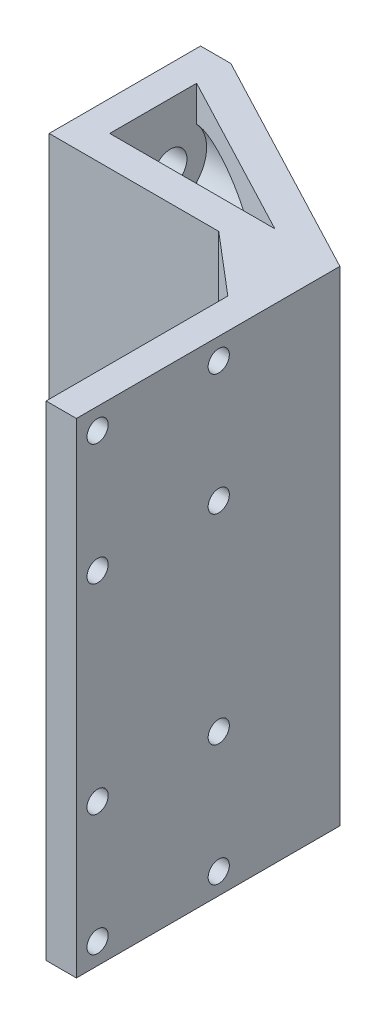
from build123d import *

# Parameters (mm, degrees)
ESQUISSE1_W             = 43
ESQUISSE1_H             = 80
BOSS_EXTRU_1_DEPTH      = 5
ESQUISSE2_W             = 5
ESQUISSE2_H             = 80
BOSS_EXTRU_2_DEPTH      = 38.5
ENL_V_MAT_EXTRU_1_REACH = 84.692
ESQUISSE3_R             = 1.75
ESQUISSE4_W             = 5
ESQUISSE4_H             = 80
BOSS_EXTRU_3_DEPTH      = 20
ENL_V_MAT_EXTRU_2_REACH = 82.206
ESQUISSE5_R             = 2.75
ENL_V_MAT_EXTRU_3_REACH = 80.13
ESQUISSE6_R             = 1.5
BOSS_EXTRU_4_DEPTH      = 80
ENL_V_MAT_EXTRU_4_REACH = 82.206
ESQUISSE8_R             = 6
CHANFREIN2_SIZE         = 8.5
CHANFREIN2_SIZE2        = 10


with BuildPart() as part:
    # Esquisse1 → Boss.-Extru.1 (new body)
    with BuildSketch(Plane.XY):
        with Locations((-11.896872358, -15.648351648)):
            Rectangle(ESQUISSE1_W, ESQUISSE1_H)
    extrude(amount=BOSS_EXTRU_1_DEPTH)

    # Esquisse2 → Boss.-Extru.2 (add)
    with BuildSketch(Plane(origin=(0, 0, 5), x_dir=(-1, 0, 0), z_dir=(0, 0, -1))):
        with Locations((-7.103127642, -15.648351648)):
            Rectangle(ESQUISSE2_W, ESQUISSE2_H)
    extrude(amount=-BOSS_EXTRU_2_DEPTH)

    # Esquisse3 → Enlèv. mat.-Extru.1 (cut, up to next)
    with BuildSketch(Plane(origin=(9.603127642, 0, 0), x_dir=(0, 0, -1), z_dir=(1, 0, 0)), mode=Mode.PRIVATE) as enl_v_mat_extru_1_sk1:
        with Locations(Location((-40, -52.148351648, 0), (0, 0, 90))):
            Circle(ESQUISSE3_R)
    enl_v_mat_extru_1_tool1 = extrude(enl_v_mat_extru_1_sk1.sketch, amount=-ENL_V_MAT_EXTRU_1_REACH, mode=Mode.PRIVATE) & part.part
    # Esquisse3 → Enlèv. mat.-Extru.1 (cut, up to next)
    with BuildSketch(Plane(origin=(9.603127642, 0, 0), x_dir=(0, 0, -1), z_dir=(1, 0, 0)), mode=Mode.PRIVATE) as enl_v_mat_extru_1_sk2:
        with Locations(Location((-40, -32.148351648, 0), (0, 0, 90))):
            Circle(ESQUISSE3_R)
    enl_v_mat_extru_1_tool2 = extrude(enl_v_mat_extru_1_sk2.sketch, amount=-ENL_V_MAT_EXTRU_1_REACH, mode=Mode.PRIVATE) & part.part
    # Esquisse3 → Enlèv. mat.-Extru.1 (cut, up to next)
    with BuildSketch(Plane(origin=(9.603127642, 0, 0), x_dir=(0, 0, -1), z_dir=(1, 0, 0)), mode=Mode.PRIVATE) as enl_v_mat_extru_1_sk3:
        with Locations(Location((-20, -32.148351648, 0), (0, 0, 90))):
            Circle(ESQUISSE3_R)
    enl_v_mat_extru_1_tool3 = extrude(enl_v_mat_extru_1_sk3.sketch, amount=-ENL_V_MAT_EXTRU_1_REACH, mode=Mode.PRIVATE) & part.part
    # Esquisse3 → Enlèv. mat.-Extru.1 (cut, up to next)
    with BuildSketch(Plane(origin=(9.603127642, 0, 0), x_dir=(0, 0, -1), z_dir=(1, 0, 0)), mode=Mode.PRIVATE) as enl_v_mat_extru_1_sk4:
        with Locations(Location((-20, -52.148351648, 0), (0, 0, 90))):
            Circle(ESQUISSE3_R)
    enl_v_mat_extru_1_tool4 = extrude(enl_v_mat_extru_1_sk4.sketch, amount=-ENL_V_MAT_EXTRU_1_REACH, mode=Mode.PRIVATE) & part.part
    # Esquisse3 → Enlèv. mat.-Extru.1 (cut, up to next)
    with BuildSketch(Plane(origin=(9.603127642, 0, 0), x_dir=(0, 0, -1), z_dir=(1, 0, 0)), mode=Mode.PRIVATE) as enl_v_mat_extru_1_sk5:
        with Locations(Location((-40, 0.851648352, 0), (0, 0, 90))):
            Circle(ESQUISSE3_R)
    enl_v_mat_extru_1_tool5 = extrude(enl_v_mat_extru_1_sk5.sketch, amount=-ENL_V_MAT_EXTRU_1_REACH, mode=Mode.PRIVATE) & part.part
    # Esquisse3 → Enlèv. mat.-Extru.1 (cut, up to next)
    with BuildSketch(Plane(origin=(9.603127642, 0, 0), x_dir=(0, 0, -1), z_dir=(1, 0, 0)), mode=Mode.PRIVATE) as enl_v_mat_extru_1_sk6:
        with Locations(Location((-40, 20.851648352, 0), (0, 0, 90))):
            Circle(ESQUISSE3_R)
    enl_v_mat_extru_1_tool6 = extrude(enl_v_mat_extru_1_sk6.sketch, amount=-ENL_V_MAT_EXTRU_1_REACH, mode=Mode.PRIVATE) & part.part
    # Esquisse3 → Enlèv. mat.-Extru.1 (cut, up to next)
    with BuildSketch(Plane(origin=(9.603127642, 0, 0), x_dir=(0, 0, -1), z_dir=(1, 0, 0)), mode=Mode.PRIVATE) as enl_v_mat_extru_1_sk7:
        with Locations(Location((-20, 20.851648352, 0), (0, 0, 90))):
            Circle(ESQUISSE3_R)
    enl_v_mat_extru_1_tool7 = extrude(enl_v_mat_extru_1_sk7.sketch, amount=-ENL_V_MAT_EXTRU_1_REACH, mode=Mode.PRIVATE) & part.part
    # Esquisse3 → Enlèv. mat.-Extru.1 (cut, up to next)
    with BuildSketch(Plane(origin=(9.603127642, 0, 0), x_dir=(0, 0, -1), z_dir=(1, 0, 0)), mode=Mode.PRIVATE) as enl_v_mat_extru_1_sk8:
        with Locations(Location((-20, 0.851648352, 0), (0, 0, 90))):
            Circle(ESQUISSE3_R)
    enl_v_mat_extru_1_tool8 = extrude(enl_v_mat_extru_1_sk8.sketch, amount=-ENL_V_MAT_EXTRU_1_REACH, mode=Mode.PRIVATE) & part.part
    add(enl_v_mat_extru_1_tool1.solids().sort_by_distance((9.603128, -52.148352, 40))[0], mode=Mode.SUBTRACT)
    add(enl_v_mat_extru_1_tool2.solids().sort_by_distance((9.603128, -32.148352, 40))[0], mode=Mode.SUBTRACT)
    add(enl_v_mat_extru_1_tool3.solids().sort_by_distance((9.603128, -32.148352, 20))[0], mode=Mode.SUBTRACT)
    add(enl_v_mat_extru_1_tool4.solids().sort_by_distance((9.603128, -52.148352, 20))[0], mode=Mode.SUBTRACT)
    add(enl_v_mat_extru_1_tool5.solids().sort_by_distance((9.603128, 0.851648, 40))[0], mode=Mode.SUBTRACT)
    add(enl_v_mat_extru_1_tool6.solids().sort_by_distance((9.603128, 20.851648, 40))[0], mode=Mode.SUBTRACT)
    add(enl_v_mat_extru_1_tool7.solids().sort_by_distance((9.603128, 20.851648, 20))[0], mode=Mode.SUBTRACT)
    add(enl_v_mat_extru_1_tool8.solids().sort_by_distance((9.603128, 0.851648, 20))[0], mode=Mode.SUBTRACT)

    # Esquisse4 → Boss.-Extru.3 (add)
    with BuildSketch(Plane(origin=(0, 0, 0), x_dir=(-1, 0, 0), z_dir=(0, 0, -1))):
        with Locations((30.896872358, -15.648351648)):
            Rectangle(ESQUISSE4_W, ESQUISSE4_H)
    extrude(amount=BOSS_EXTRU_3_DEPTH)

    # Esquisse5 → Enlèv. mat.-Extru.2 (cut, up to next)
    with BuildSketch(Plane(origin=(-28.396872358, 0, 0), x_dir=(0, 0, -1), z_dir=(1, 0, 0)), mode=Mode.PRIVATE) as enl_v_mat_extru_2_sk1:
        with Locations(Location((10, 14.351648352, 0), (0, 0, 90))):
            Circle(ESQUISSE5_R)
    enl_v_mat_extru_2_tool1 = extrude(enl_v_mat_extru_2_sk1.sketch, amount=-ENL_V_MAT_EXTRU_2_REACH, mode=Mode.PRIVATE) & part.part
    # Esquisse5 → Enlèv. mat.-Extru.2 (cut, up to next)
    with BuildSketch(Plane(origin=(-28.396872358, 0, 0), x_dir=(0, 0, -1), z_dir=(1, 0, 0)), mode=Mode.PRIVATE) as enl_v_mat_extru_2_sk2:
        with Locations(Location((10, -5.648351648, 0), (0, 0, 90))):
            Circle(ESQUISSE5_R)
    enl_v_mat_extru_2_tool2 = extrude(enl_v_mat_extru_2_sk2.sketch, amount=-ENL_V_MAT_EXTRU_2_REACH, mode=Mode.PRIVATE) & part.part
    # Esquisse5 → Enlèv. mat.-Extru.2 (cut, up to next)
    with BuildSketch(Plane(origin=(-28.396872358, 0, 0), x_dir=(0, 0, -1), z_dir=(1, 0, 0)), mode=Mode.PRIVATE) as enl_v_mat_extru_2_sk3:
        with Locations(Location((10, -25.648351648, 0), (0, 0, 90))):
            Circle(ESQUISSE5_R)
    enl_v_mat_extru_2_tool3 = extrude(enl_v_mat_extru_2_sk3.sketch, amount=-ENL_V_MAT_EXTRU_2_REACH, mode=Mode.PRIVATE) & part.part
    # Esquisse5 → Enlèv. mat.-Extru.2 (cut, up to next)
    with BuildSketch(Plane(origin=(-28.396872358, 0, 0), x_dir=(0, 0, -1), z_dir=(1, 0, 0)), mode=Mode.PRIVATE) as enl_v_mat_extru_2_sk4:
        with Locations(Location((10, -45.648351648, 0), (0, 0, 90))):
            Circle(ESQUISSE5_R)
    enl_v_mat_extru_2_tool4 = extrude(enl_v_mat_extru_2_sk4.sketch, amount=-ENL_V_MAT_EXTRU_2_REACH, mode=Mode.PRIVATE) & part.part
    add(enl_v_mat_extru_2_tool1.solids().sort_by_distance((-28.396872, 14.351648, -10))[0], mode=Mode.SUBTRACT)
    add(enl_v_mat_extru_2_tool2.solids().sort_by_distance((-28.396872, -5.648352, -10))[0], mode=Mode.SUBTRACT)
    add(enl_v_mat_extru_2_tool3.solids().sort_by_distance((-28.396872, -25.648352, -10))[0], mode=Mode.SUBTRACT)
    add(enl_v_mat_extru_2_tool4.solids().sort_by_distance((-28.396872, -45.648352, -10))[0], mode=Mode.SUBTRACT)

    # Esquisse6 → Enlèv. mat.-Extru.3 (cut, up to next)
    with BuildSketch(Plane(origin=(0, 0, 0), x_dir=(-1, 0, 0), z_dir=(0, 0, -1)), mode=Mode.PRIVATE) as enl_v_mat_extru_3_sk1:
        with Locations((18.396872358, -45.648351648)):
            Circle(ESQUISSE6_R)
    enl_v_mat_extru_3_tool1 = extrude(enl_v_mat_extru_3_sk1.sketch, amount=-ENL_V_MAT_EXTRU_3_REACH, mode=Mode.PRIVATE) & part.part
    add(enl_v_mat_extru_3_tool1.solids().sort_by_distance((-18.396872, -45.648352, 0))[0], mode=Mode.SUBTRACT)

    # Esquisse7 → Boss.-Extru.4 (add)
    with BuildSketch(Plane(origin=(0, 24.351648352, 0), x_dir=(1, 0, 0), z_dir=(0, 1, 0))):
        Polygon((9.603127642, 0), (-28.396872358, 20), (-28.396872358, 14.349760381), (-1.132327635, 0), align=None)
    extrude(amount=-BOSS_EXTRU_4_DEPTH)

    # Enlèv. mat.-Extru.4: up to this plane
    enl_v_mat_extru_4_end = Plane(origin=(9.603127642, -98.590172756, 0), z_dir=(0.46574643283262246, 0, -0.8849182223819824))
    # Esquisse8 → Enlèv. mat.-Extru.4 (cut, up to the surface)
    with BuildSketch(Plane(origin=(-28.396872358, 0, 0), x_dir=(0, 0, -1), z_dir=(1, 0, 0)), mode=Mode.PRIVATE) as enl_v_mat_extru_4_sk1:
        with Locations(Location((10, -45.648351648, 0), (0, 0, 316.465525683))):
            Circle(ESQUISSE8_R)
    enl_v_mat_extru_4_tool1 = split(extrude(enl_v_mat_extru_4_sk1.sketch, amount=ENL_V_MAT_EXTRU_4_REACH, mode=Mode.PRIVATE), bisect_by=enl_v_mat_extru_4_end, keep=Keep.BOTH, mode=Mode.PRIVATE)
    add(enl_v_mat_extru_4_tool1.solids().sort_by_distance((-28.396872, -45.648352, -10))[0], mode=Mode.SUBTRACT)
    # Esquisse8 → Enlèv. mat.-Extru.4 (cut, up to the surface)
    with BuildSketch(Plane(origin=(-28.396872358, 0, 0), x_dir=(0, 0, -1), z_dir=(1, 0, 0)), mode=Mode.PRIVATE) as enl_v_mat_extru_4_sk2:
        with Locations(Location((10, -25.648351648, 0), (0, 0, 316.465525683))):
            Circle(ESQUISSE8_R)
    enl_v_mat_extru_4_tool2 = split(extrude(enl_v_mat_extru_4_sk2.sketch, amount=ENL_V_MAT_EXTRU_4_REACH, mode=Mode.PRIVATE), bisect_by=enl_v_mat_extru_4_end, keep=Keep.BOTH, mode=Mode.PRIVATE)
    add(enl_v_mat_extru_4_tool2.solids().sort_by_distance((-28.396872, -25.648352, -10))[0], mode=Mode.SUBTRACT)
    # Esquisse8 → Enlèv. mat.-Extru.4 (cut, up to the surface)
    with BuildSketch(Plane(origin=(-28.396872358, 0, 0), x_dir=(0, 0, -1), z_dir=(1, 0, 0)), mode=Mode.PRIVATE) as enl_v_mat_extru_4_sk3:
        with Locations(Location((10, -5.648351648, 0), (0, 0, 316.465525683))):
            Circle(ESQUISSE8_R)
    enl_v_mat_extru_4_tool3 = split(extrude(enl_v_mat_extru_4_sk3.sketch, amount=ENL_V_MAT_EXTRU_4_REACH, mode=Mode.PRIVATE), bisect_by=enl_v_mat_extru_4_end, keep=Keep.BOTH, mode=Mode.PRIVATE)
    add(enl_v_mat_extru_4_tool3.solids().sort_by_distance((-28.396872, -5.648352, -10))[0], mode=Mode.SUBTRACT)
    # Esquisse8 → Enlèv. mat.-Extru.4 (cut, up to the surface)
    with BuildSketch(Plane(origin=(-28.396872358, 0, 0), x_dir=(0, 0, -1), z_dir=(1, 0, 0)), mode=Mode.PRIVATE) as enl_v_mat_extru_4_sk4:
        with Locations(Location((10, 14.351648352, 0), (0, 0, 316.465525683))):
            Circle(ESQUISSE8_R)
    enl_v_mat_extru_4_tool4 = split(extrude(enl_v_mat_extru_4_sk4.sketch, amount=ENL_V_MAT_EXTRU_4_REACH, mode=Mode.PRIVATE), bisect_by=enl_v_mat_extru_4_end, keep=Keep.BOTH, mode=Mode.PRIVATE)
    add(enl_v_mat_extru_4_tool4.solids().sort_by_distance((-28.396872, 14.351648, -10))[0], mode=Mode.SUBTRACT)

    # Chanfrein2
    chanfrein2_edges = [part.edges().sort_by_distance(p)[0] for p in [
        (4.603127642, -15.648351648, 5),
    ]]
    chanfrein2_side = [part.faces().sort_by_distance(p)[0] for p in [
        (4.603127642, -15.648351648, 24.102624942),
    ]]
    chamfer(chanfrein2_edges, length=CHANFREIN2_SIZE, length2=CHANFREIN2_SIZE2, reference=chanfrein2_side[0])


solid = part.part
